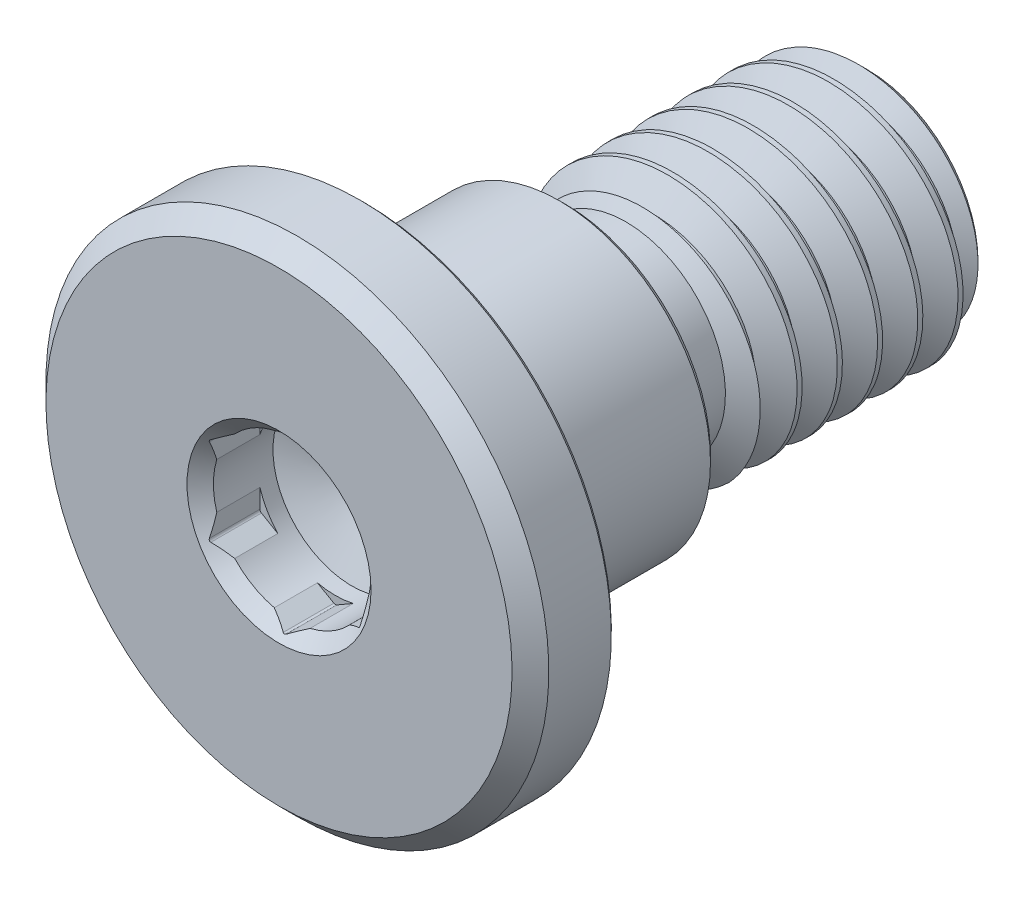
from build123d import *

# Parameters (mm, degrees)
CHAMFER1_SIZE          = 0.3655
CHAMFER4_SIZE          = 0.091375
CHAMFER2_SIZE          = 0.12
FILLET1_R              = 0.096
CHAMFER3_SIZE          = 0.3
SKETCH11_R             = 1.5675
CUT_EXTRUDE4_DEPTH     = 1.4475
CUT_EXTRUDE1_DEPTH     = 1.120365
SKETCH6_R              = 1.83
CUT_EXTRUDE2_DEPTH     = 1.4475
CUT_EXTRUDE2_DRAFT     = -45
FILLET2_R              = 0.06
FILLET3_R              = 0.37488
CUT_SWEEP1_PITCH       = 0.8
CUT_SWEEP1_HEIGHT      = 5.6
CUT_SWEEP1_RADIUS      = 2.5
CUT_SWEEP1_START_ANGLE = 90
SKETCH10_R             = 1.980384758
BOSS_EXTRUDE1_DEPTH    = 6.901467
BOSS_EXTRUDE1_TAPER    = 60


with BuildPart() as part:
    # Sketch2 → Revolve1 (revolve)
    with BuildSketch(Plane(origin=(0, 0, 0), x_dir=(0, 0, -1), z_dir=(1, 0, 0))):
        Polygon((-1.7, 5), (0, 5), (0, 3), (4, 3), (4, 2.5), (10, 2.5), (10, 0), (-1.7, 0), align=None)
    revolve(axis=Axis((0, 0, 0), (0, 0, 1)))

    # Chamfer1
    chamfer1_edges = [part.edges().sort_by_distance(p)[0] for p in [
        (0, -5, 1.7),
    ]]
    chamfer(chamfer1_edges, length=CHAMFER1_SIZE)

    # Chamfer4
    chamfer4_edges = [part.edges().sort_by_distance(p)[0] for p in [
        (0, -5, 0),
    ]]
    chamfer(chamfer4_edges, length=CHAMFER4_SIZE)

    # Sketch3 → Cut-Revolve1 (revolve, cut)
    with BuildSketch(Plane(origin=(0, 0, 0), x_dir=(0, 0, -1), z_dir=(1, 0, 0))):
        with BuildLine():
            Line((0, 3), (0.63735238, 3))
            Line((0.63735238, 3), (0.45067619, 2.81332381))
            ThreePointArc((0.45067619, 2.81332381), (0.162971574, 2.756095803), (0, 3))
        make_face()
    revolve(axis=Axis((0, 0, -10), (0, 0, 1)), mode=Mode.SUBTRACT)

    # Sketch4 → Cut-Revolve2 (revolve, cut)
    with BuildSketch(Plane(origin=(0, 0, 0), x_dir=(0, 0, -1), z_dir=(1, 0, 0))):
        Polygon((4, 2.5), (5.50146647, 2.5), (5.2, 1.977844758), (4, 1.977844758), align=None)
    revolve(axis=Axis((0, 0, -10), (0, 0, 1)), mode=Mode.SUBTRACT)

    # Chamfer2
    chamfer2_edges = [part.edges().sort_by_distance(p)[0] for p in [
        (0, -3, -4),
    ]]
    chamfer(chamfer2_edges, length=CHAMFER2_SIZE)

    # Fillet1
    fillet1_edges = [part.edges().sort_by_distance(p)[0] for p in [
        (0, -1.977844758, -4),
    ]]
    fillet(fillet1_edges, radius=FILLET1_R)

    # Chamfer3
    chamfer3_edges = [part.edges().sort_by_distance(p)[0] for p in [
        (0, -2.5, -10),
    ]]
    chamfer(chamfer3_edges, length=CHAMFER3_SIZE)

    # Sketch11 → Cut-Extrude4 (cut)
    with BuildSketch(Plane.XY.offset(1.7)):
        Circle(SKETCH11_R)
    extrude(amount=-CUT_EXTRUDE4_DEPTH, mode=Mode.SUBTRACT)

    # Sketch5 → Cut-Extrude1 (cut)
    with BuildSketch(Plane.XY.offset(1.7)):
        Polygon((0, 1.732050808), (-1.5, 0.866025404), (-1.5, -0.866025404), (0, -1.732050808), (1.5, -0.866025404), (1.5, 0.866025404), align=None)
    extrude(amount=-CUT_EXTRUDE1_DEPTH, mode=Mode.SUBTRACT)


with BuildPart() as cut_extrude2_tool:
    # Sketch6 → Cut-Extrude2 (with draft: the straight prism first)
    with BuildSketch(Plane.XY.offset(1.7)):
        Circle(SKETCH6_R)
    extrude(amount=-CUT_EXTRUDE2_DEPTH)
    # Cut-Extrude2: the draft: its side faces are tilted about the plane it starts from
    cut_extrude2_sides = [cut_extrude2_tool.faces().sort_by_distance(p)[0] for p in [
        (-1.83, 0, 0.97625),
    ]]
    draft(cut_extrude2_sides, Plane.XY.offset(1.7), CUT_EXTRUDE2_DRAFT)


with BuildPart() as part_1:
    add(part.part)

    # Cut-Extrude2: cut by cut_extrude2_tool
    add(cut_extrude2_tool.part, mode=Mode.SUBTRACT)

    # Cut-Extrude3 cone 1 section (through the dimple's axis) → Cut-Extrude3 (revolve, cut)
    with BuildSketch(Plane(origin=(0, 0, 0.2525), x_dir=(0, -1, 0), z_dir=(1, 0, 0))):
        Polygon((0, 0), (1.5675, 0), (0, 0.570523342), align=None)
    revolve(axis=Axis((0, 0, 0.2525), (0, 0, -1)), mode=Mode.SUBTRACT)

    # Fillet2
    fillet2_edges = [part_1.edges().sort_by_distance(p)[0] for p in [
        (1.5, 0.866025404, 1.090842904),
        (0, 1.732050808, 1.090842904),
        (-1.5, 0.866025404, 1.090842904),
        (0, -1.732050808, 1.090842904),
        (1.5, -0.866025404, 1.090842904),
        (-1.5, -0.866025404, 1.090842904),
    ]]
    fillet(fillet2_edges, radius=FILLET2_R)

    # Fillet3
    fillet3_edges = [part_1.edges().sort_by_distance(p)[0] for p in [
        (0, -3, -0.63735238),
    ]]
    fillet(fillet3_edges, radius=FILLET3_R)


with BuildPart() as body_2:
    # Split1: the piece on the far side of the plane
    add(part_1.part)
    split(bisect_by=Plane.XY.offset(-5.2), keep=Keep.BOTTOM)

    # Cut-Sweep1: sweep along a helix
    with BuildLine() as cut_sweep1_path:
        add(Helix(CUT_SWEEP1_PITCH, CUT_SWEEP1_HEIGHT, CUT_SWEEP1_RADIUS, center=(0, 0, -10), direction=(0, 0, 1), mode=Mode.PRIVATE).rotate(Axis((0, 0, -10), (0, 0, 1)), CUT_SWEEP1_START_ANGLE))
    # Sketch7 → Cut-Sweep1 (sweep, cut)
    with BuildSketch(Plane(origin=(0, 0, 0), x_dir=(0, 0, -1), z_dir=(1, 0, 0))):
        Polygon((10.3, 1.980384758), (10.4, 1.980384758), (10.725, 2.54330127), (9.975, 2.54330127), align=None)
    sweep(path=cut_sweep1_path.line, is_frenet=True, mode=Mode.SUBTRACT)


with BuildPart() as part_2:
    add(part_1.part)

    # Split1
    split(bisect_by=Plane.XY.offset(-5.2), keep=Keep.TOP)

    add(body_2.part)  # Boss-Extrude1 merges body 2
    # Sketch10 → Boss-Extrude1 (add, through all)
    with BuildSketch(Plane.XY.offset(-5.20146647)):
        Circle(SKETCH10_R)
    extrude(amount=BOSS_EXTRUDE1_DEPTH, taper=BOSS_EXTRUDE1_TAPER)


solid = part_2.part
